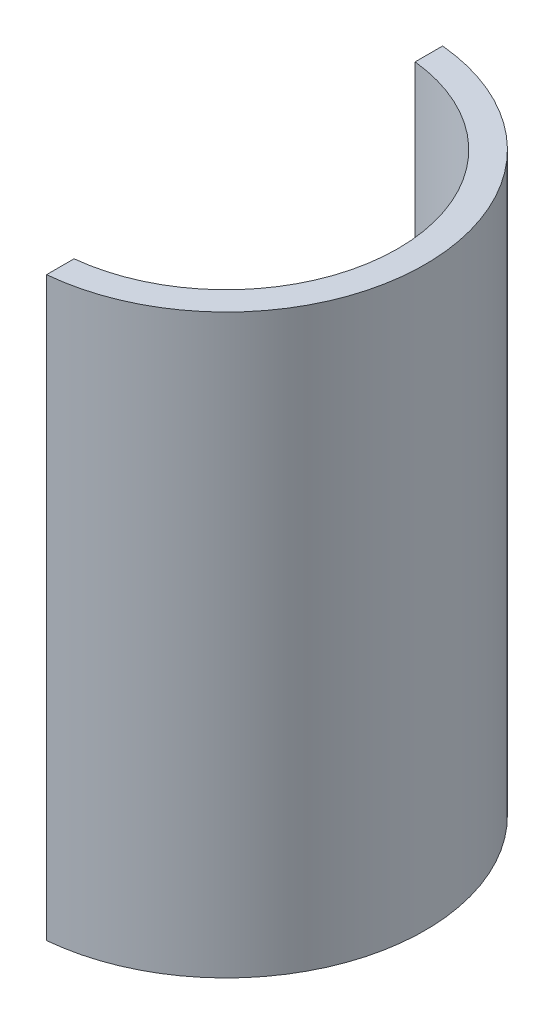
from build123d import *

# Parameters (mm, degrees)
SKETCH1_R           = 40
SKETCH1_R_2         = 34.5
BOSS_EXTRUDE1_DEPTH = 116
CUT_EXTRUDE1_START  = -123
CUT_EXTRUDE1_DEPTH  = 123


with BuildPart() as part:
    # Sketch1 → Boss-Extrude1 (new body)
    with BuildSketch(Plane(origin=(0, 0, 0), x_dir=(1, 0, 0), z_dir=(0, 1, 0))):
        with Locations(Location((0, 0, 0), (0, 0, 90))):
            Circle(SKETCH1_R)
        with Locations(Location((0, 0, 0), (0, 0, 90))):
            Circle(SKETCH1_R_2, mode=Mode.SUBTRACT)
    extrude(amount=BOSS_EXTRUDE1_DEPTH)

    # Sketch2 → Cut-Extrude1 (cut)
    with BuildSketch(Plane(origin=(0, 116, 0), x_dir=(1, 0, 0), z_dir=(0, 1, 0)).offset(CUT_EXTRUDE1_START)):
        with BuildLine():
            Line((3.696203427, 39.828859891), (3.696203427, -39.828859891))
            ThreePointArc((3.696203427, -39.828859891), (-40, 0), (3.696203427, 39.828859891))
        make_face()
    extrude(amount=CUT_EXTRUDE1_DEPTH, mode=Mode.SUBTRACT)


solid = part.part
